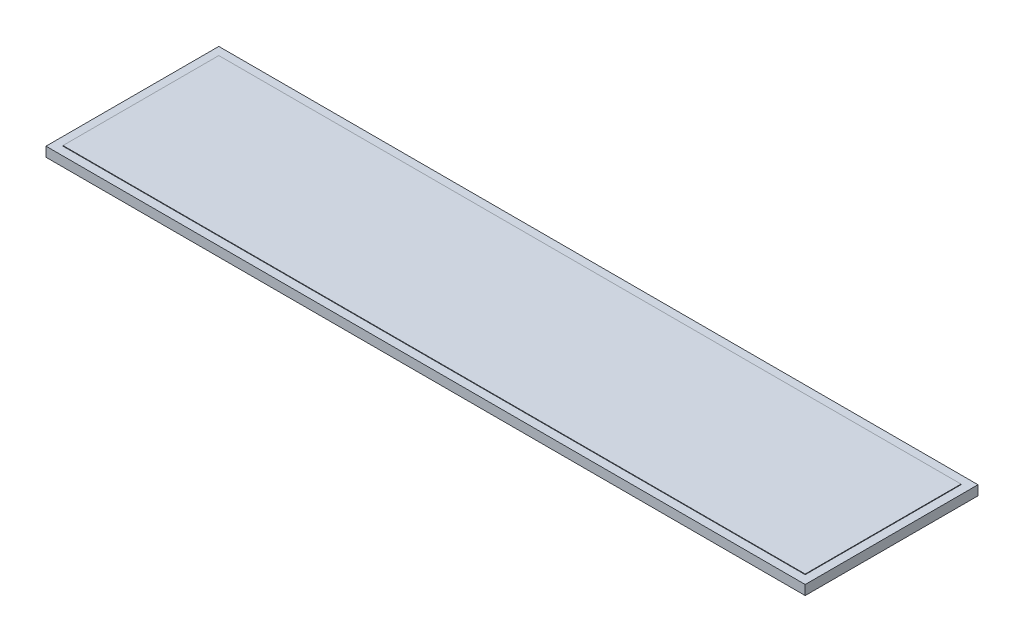
from build123d import *

# Parameters (mm, degrees)
SKETCH_1_W           = 134
SKETCH_1_H           = 30.5
EXTRUDE_1_DEPTH      = 1.8
SKETCH_2_OUTSIDE_W   = 163.488
SKETCH_2_OUTSIDE_H   = 59.988
SKETCH_2_OUTSIDE_W_2 = 131
SKETCH_2_OUTSIDE_H_2 = 27.5
CUT_EXTRUDE_2_DEPTH  = 0.1


with BuildPart() as part:
    # Эскиз1 → Бобышка-Вытянуть1 (new body)
    with BuildSketch(Plane(origin=(0, 0, 0), x_dir=(1, 0, 0), z_dir=(0, 1, 0))):
        Rectangle(SKETCH_1_W, SKETCH_1_H)
    extrude(amount=-EXTRUDE_1_DEPTH)

    # Эскиз2 outside → Вырез-Вытянуть2 (cut)
    with BuildSketch(Plane(origin=(0, 0, 0), x_dir=(1, 0, 0), z_dir=(0, 1, 0))):
        Rectangle(SKETCH_2_OUTSIDE_W, SKETCH_2_OUTSIDE_H)
        Rectangle(SKETCH_2_OUTSIDE_W_2, SKETCH_2_OUTSIDE_H_2, mode=Mode.SUBTRACT)
    extrude(amount=-CUT_EXTRUDE_2_DEPTH, mode=Mode.SUBTRACT)


solid = part.part
